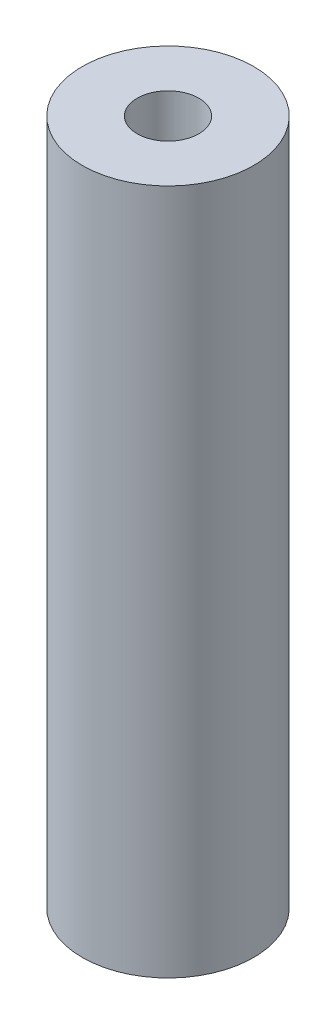
from build123d import *

# Parameters (mm, degrees)
SKETCH_1_R      = 50
SKETCH_1_R_2    = 18
EXTRUDE_1_DEPTH = 400


with BuildPart() as part:
    # 草图1 → 凸台-拉伸1 (new body)
    with BuildSketch(Plane(origin=(0, 0, 0), x_dir=(1, 0, 0), z_dir=(0, 1, 0))):
        with Locations(Location((0, 0, 0), (0, 0, 270))):
            Circle(SKETCH_1_R)
        with Locations(Location((0, 0, 0), (0, 0, 270))):
            Circle(SKETCH_1_R_2, mode=Mode.SUBTRACT)
    extrude(amount=EXTRUDE_1_DEPTH)


solid = part.part
